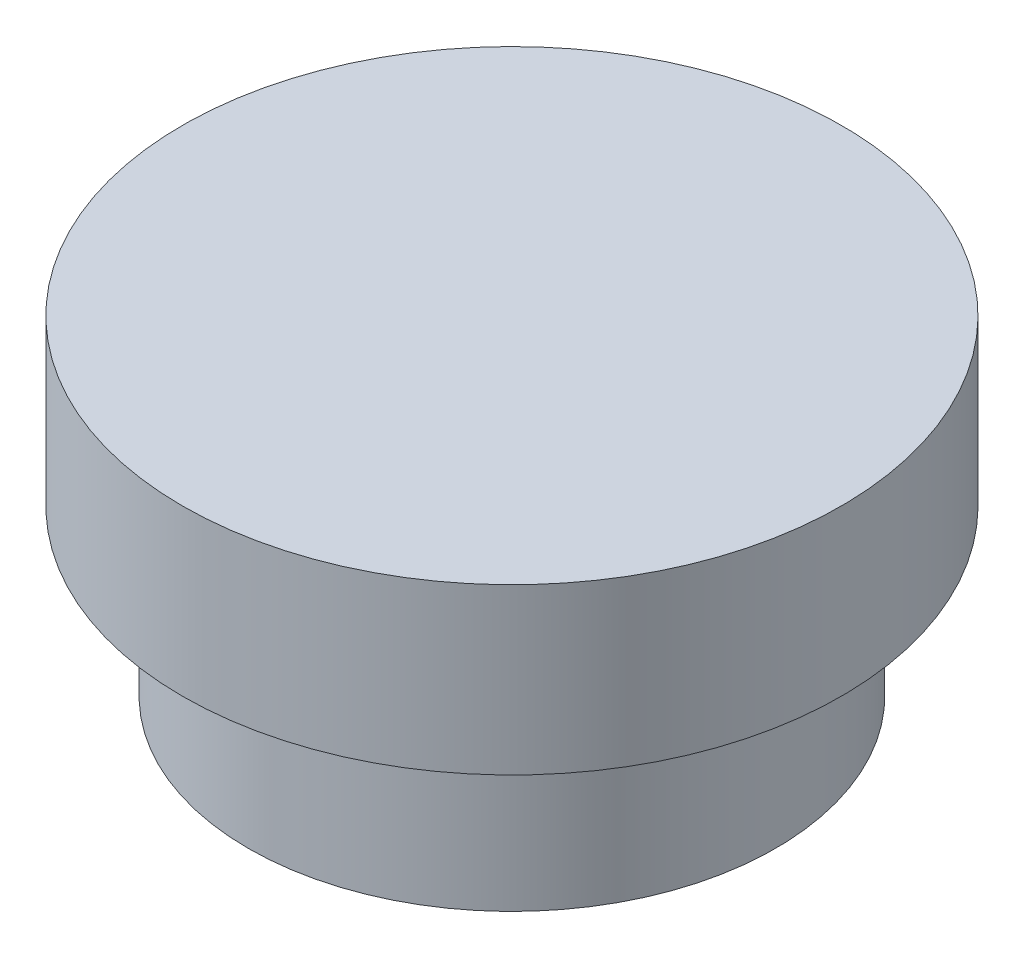
from build123d import *


with BuildPart() as part:
    # Sketch1 → Revolve1 (revolve)
    with BuildSketch(Plane.XY, mode=Mode.PRIVATE) as revolve1_sk:
        Polygon((0, 0), (-10, 0), (-10, -5), (-8, -5), (-8, -10), (0, -10), align=None)
    revolve(revolve1_sk.sketch.rotate(Axis((0, 16.375352252, 0), (0, -1, 0)), 270), axis=Axis((0, 16.375352252, 0), (0, -1, 0)))


solid = part.part
